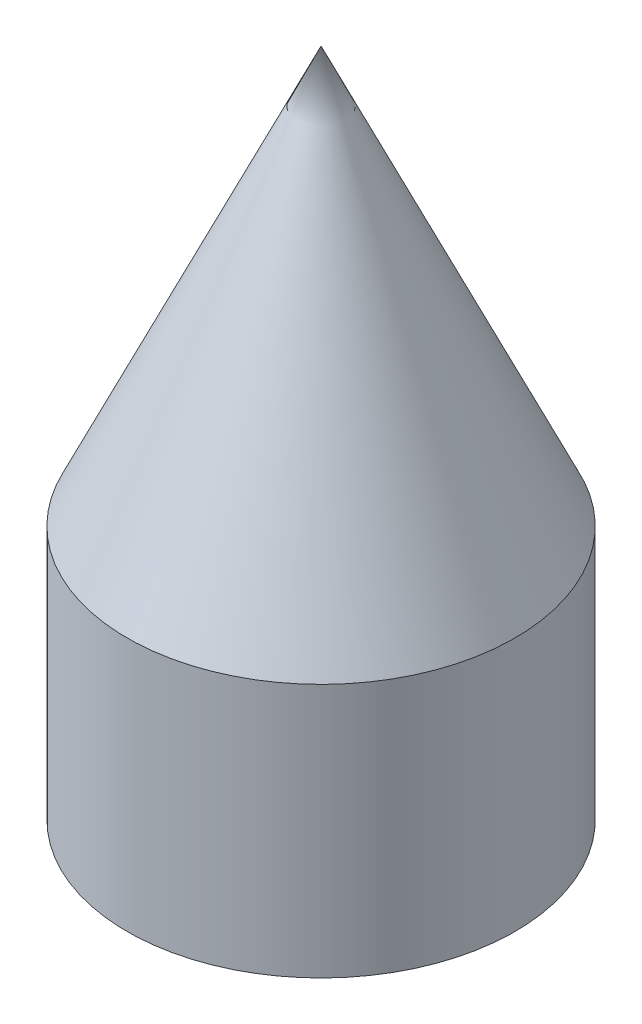
from build123d import *


with BuildPart() as part:
    # Esquisse1 → Révolution1 (revolve)
    with BuildSketch(Plane.XY, mode=Mode.PRIVATE) as r_volution1_sk:
        Polygon((3.1, 0), (3.1, 6), (0, 6), (0, 21.081492215), (6.1, 8), (6.1, 0), align=None)
    revolve(r_volution1_sk.sketch.rotate(Axis((0, 0, 0), (0, 1, 0)), 90), axis=Axis((0, 0, 0), (0, 1, 0)))


solid = part.part
